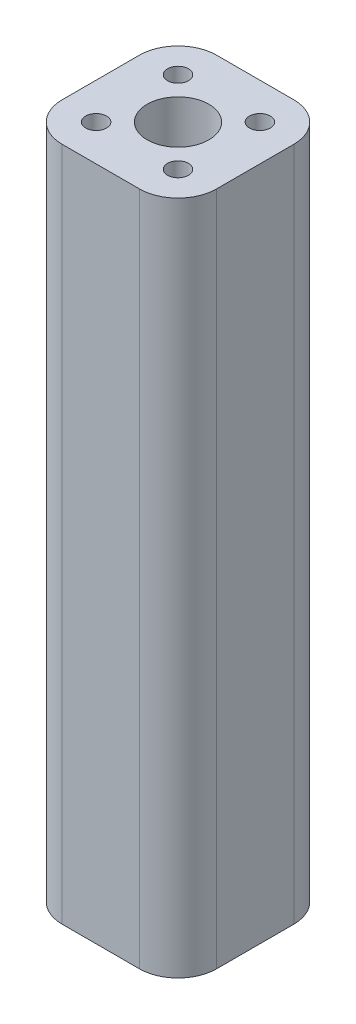
from build123d import *

# Parameters (mm, degrees)
SKETCH1_W           = 40
SKETCH1_H           = 40
SKETCH1_R           = 2.7
SKETCH1_R_2         = 8
BOSS_EXTRUDE1_DEPTH = 175
FILLET1_R           = 10


with BuildPart() as part:
    # Sketch1 → Boss-Extrude1 (new body)
    with BuildSketch(Plane(origin=(0, 0, 0), x_dir=(1, 0, 0), z_dir=(0, 1, 0))):
        Rectangle(SKETCH1_W, SKETCH1_H)
        with Locations(Location((-10.606601718, 10.606601718, 0), (0, 0, 270))):
            Circle(SKETCH1_R, mode=Mode.SUBTRACT)
        with Locations(Location((10.606601718, 10.606601718, 0), (0, 0, 270))):
            Circle(SKETCH1_R, mode=Mode.SUBTRACT)
        with Locations(Location((10.606601718, -10.606601718, 0), (0, 0, 270))):
            Circle(SKETCH1_R, mode=Mode.SUBTRACT)
        with Locations(Location((-10.606601718, -10.606601718, 0), (0, 0, 270))):
            Circle(SKETCH1_R, mode=Mode.SUBTRACT)
        with Locations(Location((0, 0, 0), (0, 0, 270))):
            Circle(SKETCH1_R_2, mode=Mode.SUBTRACT)
    extrude(amount=BOSS_EXTRUDE1_DEPTH)

    # Fillet1
    fillet1_edges = [part.edges().sort_by_distance(p)[0] for p in [
        (20, 87.5, 20),
        (-20, 87.5, 20),
        (-20, 87.5, -20),
        (20, 87.5, -20),
    ]]
    fillet(fillet1_edges, radius=FILLET1_R)


solid = part.part
